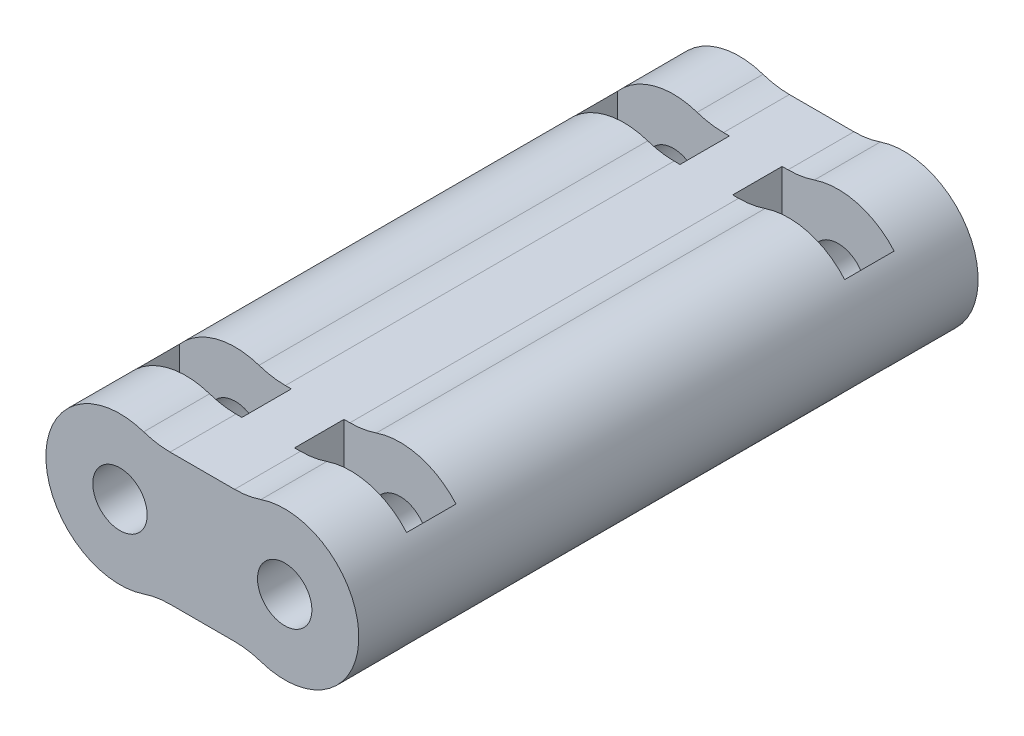
from build123d import *

# Parameters (mm, degrees)
ESBO_O1_R                  = 1.65
RESSALTO_EXTRUS_O1_DEPTH   = 37.6
FILETE1_R                  = 5
CORTE_EXTRUS_O1_DEPTH      = 40.041772501
CORTE_EXTRUS_O1_DEPTH_BACK = 40.041772501
ESBO_O2_W                  = 6.8
ESBO_O2_H                  = 3


with BuildPart() as part:
    # Esboço1 → Ressalto-extrusão1 (new body)
    with BuildSketch(Plane.XY):
        with BuildLine():
            Line((-2.938447187, 4), (2.938447187, 4))
            ThreePointArc((2.938447187, 4), (9.5, 0), (2.938447187, -4))
            Line((2.938447187, -4), (-2.938447187, -4))
            ThreePointArc((-2.938447187, -4), (-9.5, 0), (-2.938447187, 4))
        make_face()
        with Locations((-5, 0)):
            Circle(ESBO_O1_R, mode=Mode.SUBTRACT)
        with Locations((5, 0)):
            Circle(ESBO_O1_R, mode=Mode.SUBTRACT)
    extrude(amount=RESSALTO_EXTRUS_O1_DEPTH)

    # Filete1
    filete1_edges = [part.edges().sort_by_distance(p)[0] for p in [
        (-2.938447187, 4, 18.8),
        (2.938447187, 4, 18.8),
        (2.938447187, -4, 18.8),
        (-2.938447187, -4, 18.8),
    ]]
    fillet(filete1_edges, radius=FILETE1_R)

    # Esboço2 → Corte-extrusão1 (cut, two sides: drawn at the far end of the back side and taken through both)
    with BuildSketch(Plane(origin=(0, 0, 0), x_dir=(1, 0, 0), z_dir=(0, 1, 0)).offset(-CORTE_EXTRUS_O1_DEPTH_BACK)):
        with Locations((-5, -5.5)):
            Rectangle(ESBO_O2_W, ESBO_O2_H)
        with Locations((5, -5.5)):
            Rectangle(ESBO_O2_W, ESBO_O2_H)
        with Locations((5, -32.1)):
            Rectangle(ESBO_O2_W, ESBO_O2_H)
        with Locations((-5, -32.1)):
            Rectangle(ESBO_O2_W, ESBO_O2_H)
    extrude(amount=CORTE_EXTRUS_O1_DEPTH + CORTE_EXTRUS_O1_DEPTH_BACK, mode=Mode.SUBTRACT)


solid = part.part
